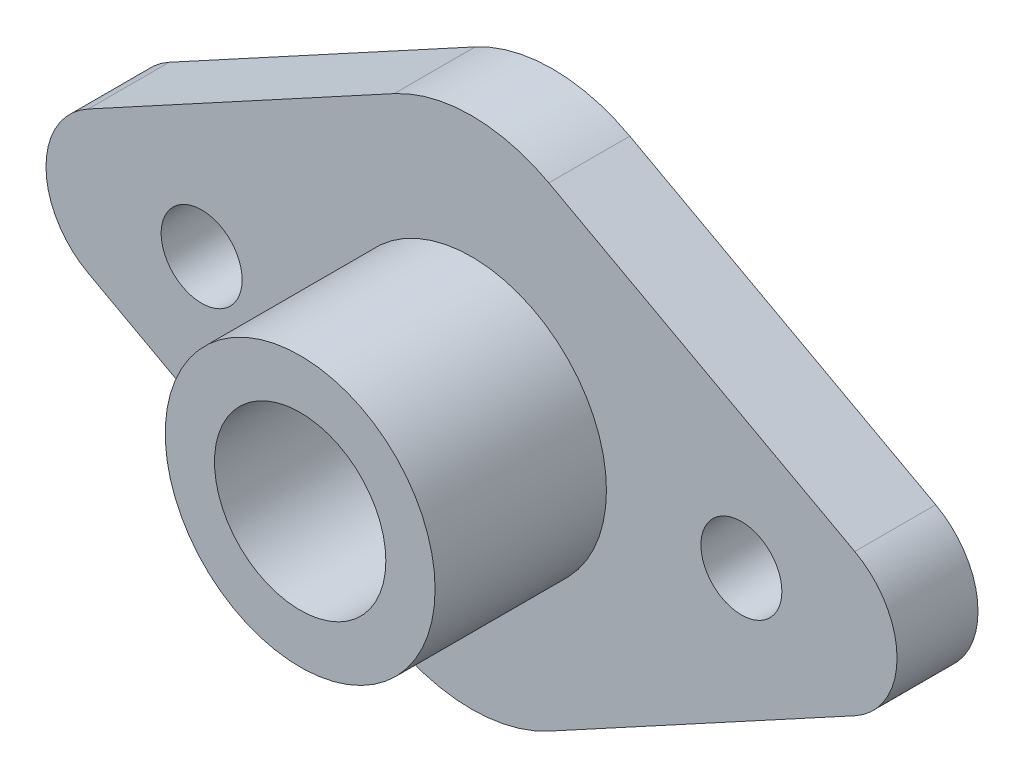
from build123d import *

# Parameters (mm, degrees)
SKETCH1_R           = 3.175
SKETCH1_R_2         = 1.5
BOSS_EXTRUDE1_DEPTH = 3
SKETCH2_R           = 5
SKETCH2_R_2         = 3.175
BOSS_EXTRUDE2_DEPTH = 6.35


with BuildPart() as part:
    # Sketch1 → Boss-Extrude1 (new body)
    with BuildSketch(Plane.XY):
        with BuildLine():
            Line((-2.865229492, 8.796665767), (-14.200395451, 2.635832883))
            ThreePointArc((-14.200395451, 2.635832883), (-15.767780705, 0), (-14.200395451, -2.635832883))
            Line((-14.200395451, -2.635832883), (-2.865229492, -8.796665767))
            ThreePointArc((-2.865229492, -8.796665767), (0, -9.525), (2.865229492, -8.796665767))
            Line((2.865229492, -8.796665767), (14.200395451, -2.635832883))
            ThreePointArc((14.200395451, -2.635832883), (15.767780705, 0), (14.200395451, 2.635832883))
            Line((14.200395451, 2.635832883), (2.865229492, 8.796665767))
            ThreePointArc((2.865229492, 8.796665767), (0, 9.525), (-2.865229492, 8.796665767))
        make_face()
        Circle(SKETCH1_R, mode=Mode.SUBTRACT)
        with Locations((10, 0)):
            Circle(SKETCH1_R_2, mode=Mode.SUBTRACT)
        with Locations((-10, 0)):
            Circle(SKETCH1_R_2, mode=Mode.SUBTRACT)
    extrude(amount=BOSS_EXTRUDE1_DEPTH)

    # Sketch2 → Boss-Extrude2 (add)
    with BuildSketch(Plane.XY.offset(3)):
        Circle(SKETCH2_R)
        Circle(SKETCH2_R_2, mode=Mode.SUBTRACT)
    extrude(amount=BOSS_EXTRUDE2_DEPTH)


solid = part.part
